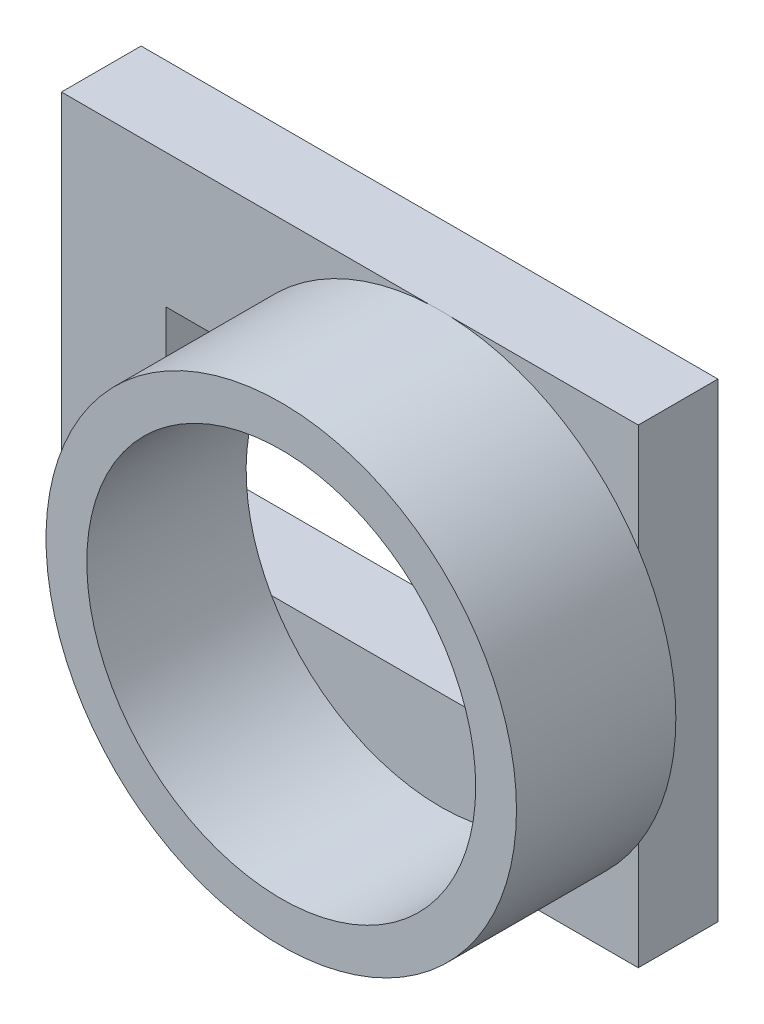
from build123d import *

# Parameters (mm, degrees)
SKETCH1_W           = 36.2
SKETCH1_H           = 29.5
BOSS_EXTRUDE1_DEPTH = 5
SKETCH3_W           = 33.053
SKETCH3_H           = 12.372
CUT_EXTRUDE1_DEPTH  = 47.964774033
SKETCH4_W           = 5
SKETCH4_H           = 12.372
BOSS_EXTRUDE2_DEPTH = 3.5
SKETCH5_R           = 14.763665
SKETCH5_R_2         = 12.2036
BOSS_EXTRUDE3_DEPTH = 10


with BuildPart() as part:
    # Sketch1 → Boss-Extrude1 (new body)
    with BuildSketch(Plane.XY):
        with Locations((18.1, 14.75)):
            Rectangle(SKETCH1_W, SKETCH1_H)
    extrude(amount=BOSS_EXTRUDE1_DEPTH)

    # Sketch3 → Cut-Extrude1 (cut, through all)
    with BuildSketch(Plane.XY.offset(5)):
        with Locations((18.1, 14.914)):
            Rectangle(SKETCH3_W, SKETCH3_H)
    extrude(amount=-CUT_EXTRUDE1_DEPTH, mode=Mode.SUBTRACT)

    # Sketch4 → Boss-Extrude2 (add)
    with BuildSketch(Plane.XY.offset(5)):
        with Locations((4.0735, 14.914)):
            Rectangle(SKETCH4_W, SKETCH4_H)
        with Locations((32.1265, 14.914)):
            Rectangle(SKETCH4_W, SKETCH4_H)
    extrude(amount=-BOSS_EXTRUDE2_DEPTH)

    # Sketch5 → Boss-Extrude3 (add)
    with BuildSketch(Plane.XY.offset(5)):
        with Locations(Location((23.79465, 14.75, 0), (0, 0, 204.072563575))):
            Circle(SKETCH5_R)
        with Locations(Location((23.79465, 14.75, 0), (0, 0, 209.568314483))):
            Circle(SKETCH5_R_2, mode=Mode.SUBTRACT)
    extrude(amount=BOSS_EXTRUDE3_DEPTH)


solid = part.part
